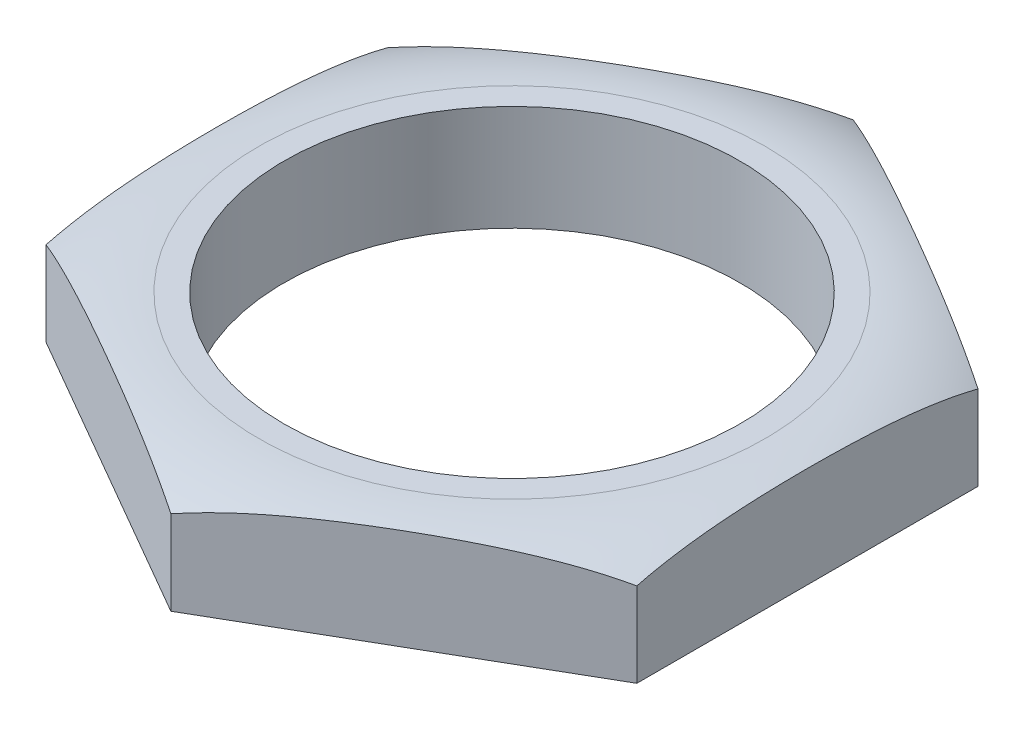
from build123d import *

# Parameters (mm, degrees)
EXTRUDE_1_DEPTH = 2.5
M12X1_252_D     = 10.8


with BuildPart() as part:
    # Эскиз1 → Бобышка-Вытянуть1 (new body)
    with BuildSketch(Plane(origin=(0, 0, 0), x_dir=(1, 0, 0), z_dir=(0, 1, 0))):
        Polygon((0, -8.082903769), (7, -4.041451884), (7, 4.041451884), (0, 8.082903769), (-7, 4.041451884), (-7, -4.041451884), align=None)
    extrude(amount=EXTRUDE_1_DEPTH)

    # Эскиз2 → Вырез-Повернуть1 (revolve, cut)
    with BuildSketch(Plane(origin=(0, 0, 0), x_dir=(0, 0, -1), z_dir=(1, 0, 0)), mode=Mode.PRIVATE) as cut_revolve_1_sk:
        with BuildLine():
            Line((-8.082903769, 2.5), (-8.082903769, 2))
            ThreePointArc((-8.082903769, 2), (-7.071037827, 2.373249344), (-6, 2.5))
            Line((-6, 2.5), (-8.082903769, 2.5))
        make_face()
    revolve(cut_revolve_1_sk.sketch.rotate(Axis((0, 0, 0), (0, 1, 0)), 180), axis=Axis((0, 0, 0), (0, 1, 0)), mode=Mode.SUBTRACT)

    # Отверстие обработанное метчиком M12x1.252 (through all)
    with Locations(Plane.ZX.offset(2.5)):
        with Locations((0, 0)):
            Hole(M12X1_252_D / 2)


solid = part.part
